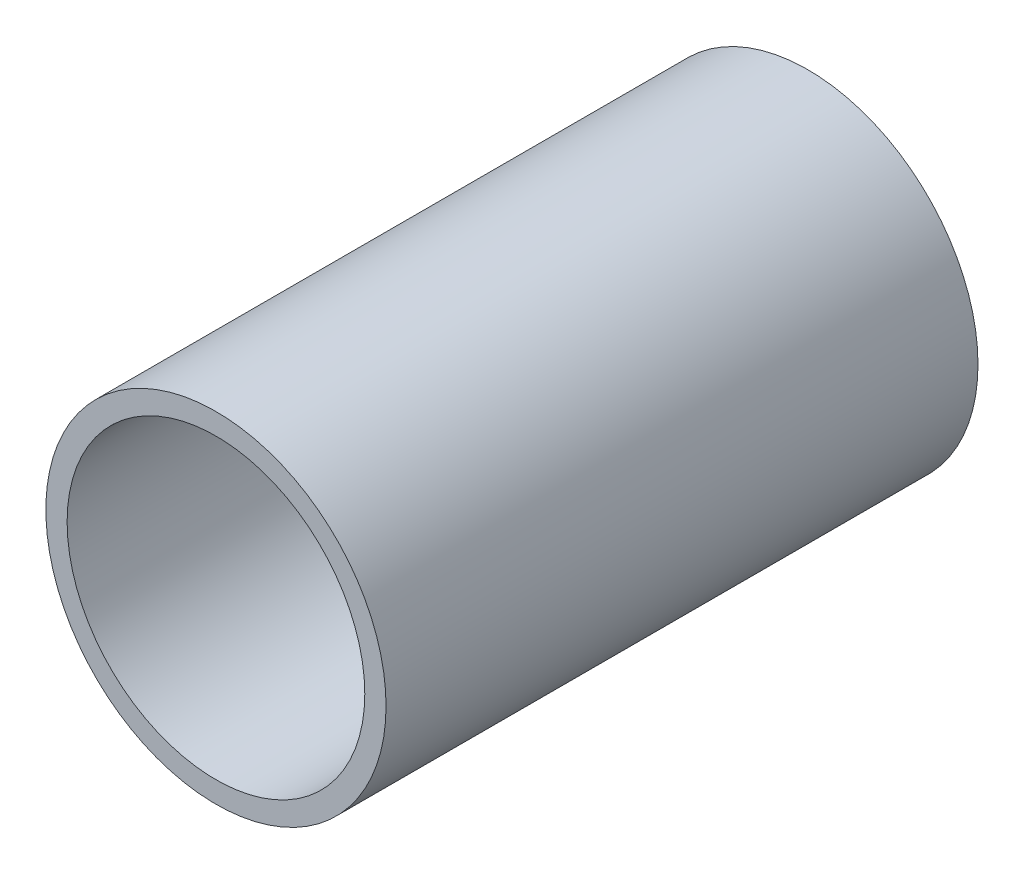
from build123d import *

# Parameters (mm, degrees)
SKETCH1_R           = 12.7
SKETCH1_R_2         = 11.1125
BOSS_EXTRUDE1_DEPTH = 44.196


with BuildPart() as part:
    # Sketch1 → Boss-Extrude1 (new body)
    with BuildSketch(Plane.XY):
        Circle(SKETCH1_R)
        Circle(SKETCH1_R_2, mode=Mode.SUBTRACT)
    extrude(amount=BOSS_EXTRUDE1_DEPTH)


solid = part.part
